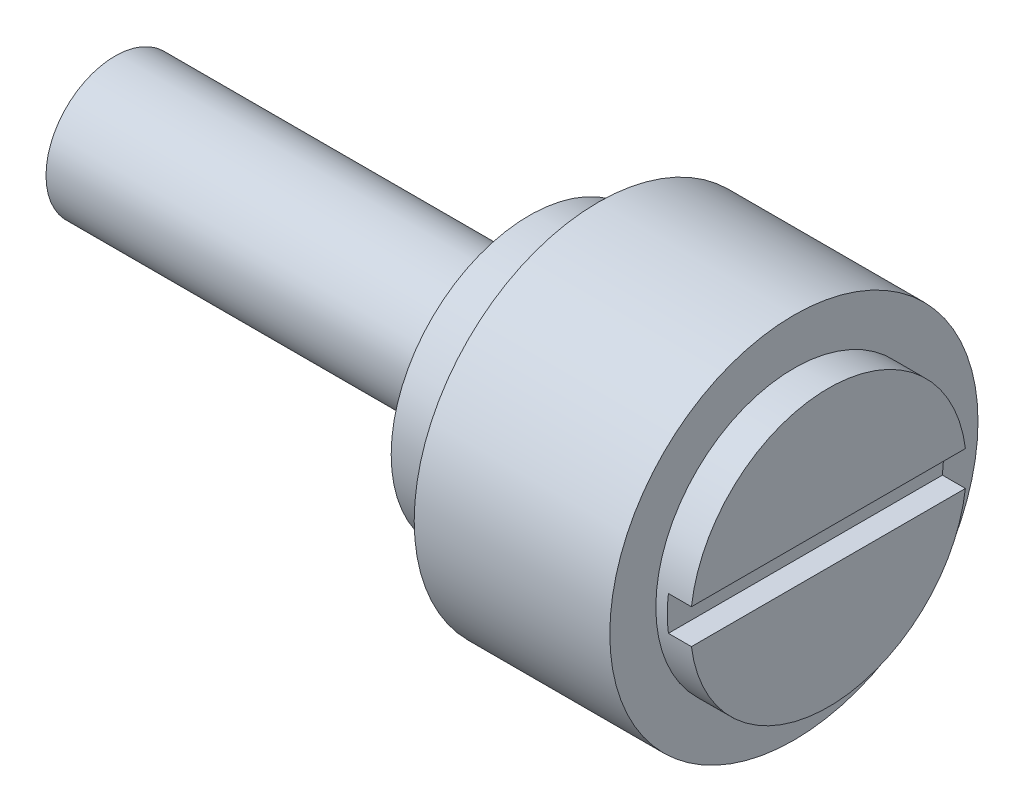
from build123d import *

# Parameters (mm, degrees)
SKETCH_2_W          = 16
SKETCH_2_H          = 1.5
CUT_EXTRUDE_1_DEPTH = 1


with BuildPart() as part:
    # Эскиз1 → Повернуть1 (revolve)
    with BuildSketch(Plane.XY, mode=Mode.PRIVATE) as revolve_1_sk:
        Polygon((0, 0), (0, 3), (18, 3), (18, 6), (21, 6), (21, 8), (29.5, 8), (29.5, 6), (31, 6), (31, 0), align=None)
    revolve(revolve_1_sk.sketch.rotate(Axis((0, 0, 0), (1, 0, 0)), 90), axis=Axis((0, 0, 0), (1, 0, 0)))

    # Эскиз2 → Вырез-Вытянуть1 (cut)
    with BuildSketch(Plane(origin=(31, 0, 0), x_dir=(0, 0, -1), z_dir=(1, 0, 0))):
        Rectangle(SKETCH_2_W, SKETCH_2_H)
    extrude(amount=-CUT_EXTRUDE_1_DEPTH, mode=Mode.SUBTRACT)


solid = part.part
